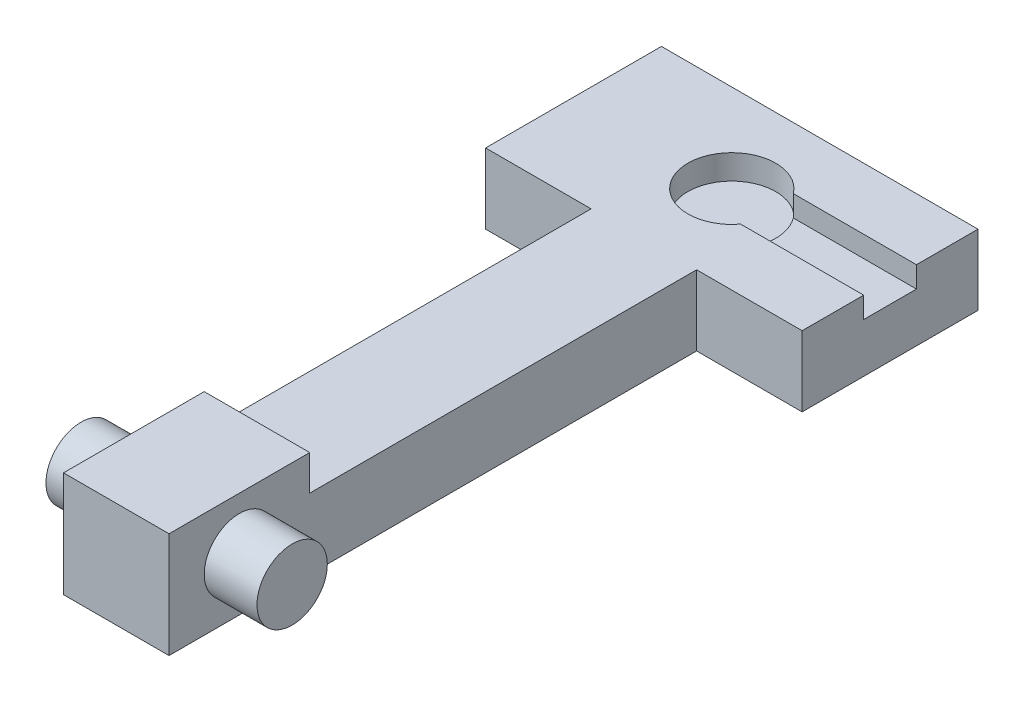
from build123d import *

# Parameters (mm, degrees)
BOSS_EXTRUDE1_DEPTH      = 20
SKETCH2_R                = 12.5
CUT_EXTRUDE1_DEPTH       = 7
SKETCH3_W                = 38
SKETCH3_H                = 15
CUT_EXTRUDE2_DEPTH       = 6
SKETCH7_W                = 30
SKETCH7_H                = 40
BOSS_EXTRUDE2_DEPTH      = 10
BOSS_EXTRUDE3_DEPTH      = 15
BOSS_EXTRUDE3_DEPTH_BACK = 45
SKETCH8_R                = 10


with BuildPart() as part:
    # Sketch1 → Boss-Extrude1 (new body)
    with BuildSketch(Plane(origin=(0, 0, 0), x_dir=(1, 0, 0), z_dir=(0, 1, 0))):
        Polygon((0, 0), (30, 0), (30, 150), (60, 150), (60, 200), (-30, 200), (-30, 150), (0, 150), align=None)
    extrude(amount=BOSS_EXTRUDE1_DEPTH)

    # Sketch2 → Cut-Extrude1 (cut)
    with BuildSketch(Plane(origin=(0, 20, 0), x_dir=(1, 0, 0), z_dir=(0, 1, 0))):
        with Locations(Location((15, 175, 0), (0, 0, 270))):
            Circle(SKETCH2_R)
    extrude(amount=-CUT_EXTRUDE1_DEPTH, mode=Mode.SUBTRACT)

    # Sketch3 → Cut-Extrude2 (cut)
    with BuildSketch(Plane(origin=(0, 20, 0), x_dir=(1, 0, 0), z_dir=(0, 1, 0))):
        with Locations((41, 175)):
            Rectangle(SKETCH3_W, SKETCH3_H)
    extrude(amount=-CUT_EXTRUDE2_DEPTH, mode=Mode.SUBTRACT)

    # Sketch7 → Boss-Extrude2 (add)
    with BuildSketch(Plane(origin=(0, 20, 0), x_dir=(1, 0, 0), z_dir=(0, 1, 0))):
        with Locations((15, 20)):
            Rectangle(SKETCH7_W, SKETCH7_H)
    extrude(amount=BOSS_EXTRUDE2_DEPTH)

    # Sketch8 → Boss-Extrude3 (add, two sides: drawn at the far end of the back side and taken through both)
    with BuildSketch(Plane(origin=(30, 0, 0), x_dir=(0, 0, -1), z_dir=(1, 0, 0)).offset(-BOSS_EXTRUDE3_DEPTH_BACK)):
        with Locations((20, 15)):
            Circle(SKETCH8_R)
    extrude(amount=BOSS_EXTRUDE3_DEPTH + BOSS_EXTRUDE3_DEPTH_BACK)


solid = part.part
